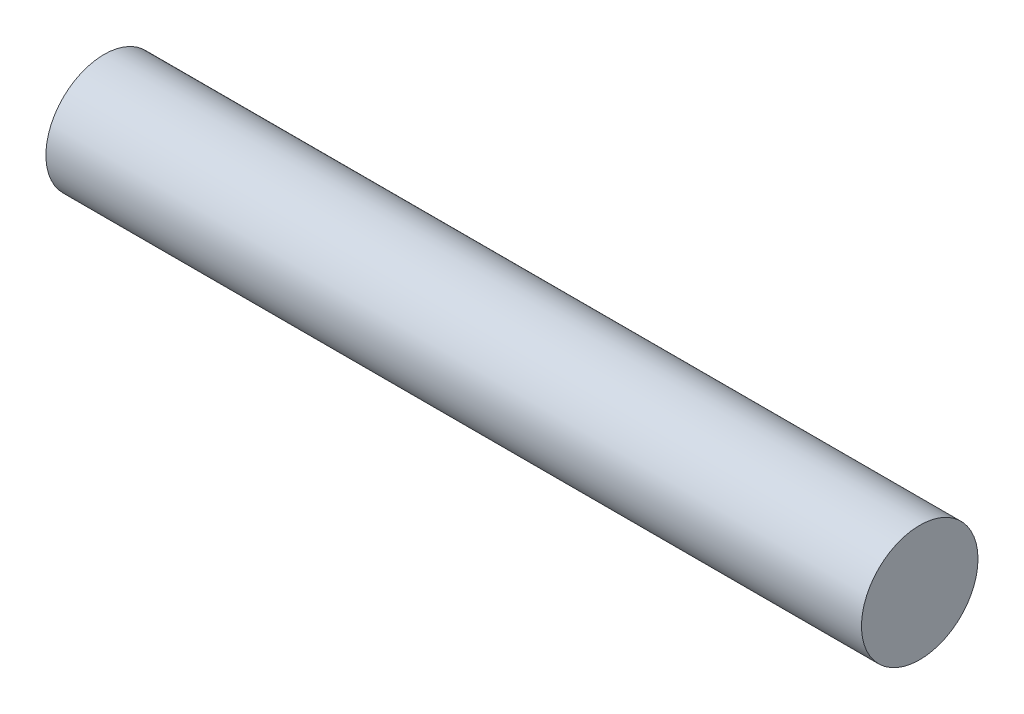
from build123d import *

# Parameters (mm, degrees)
SKETCH1_R           = 6.35
BOSS_EXTRUDE1_DEPTH = 44.45


with BuildPart() as part:
    # Sketch1 → Boss-Extrude1 (new, symmetric)
    with BuildSketch(Plane(origin=(0, 0, 0), x_dir=(0, 0, -1), z_dir=(1, 0, 0))):
        Circle(SKETCH1_R)
    extrude(amount=BOSS_EXTRUDE1_DEPTH, both=True)


solid = part.part
